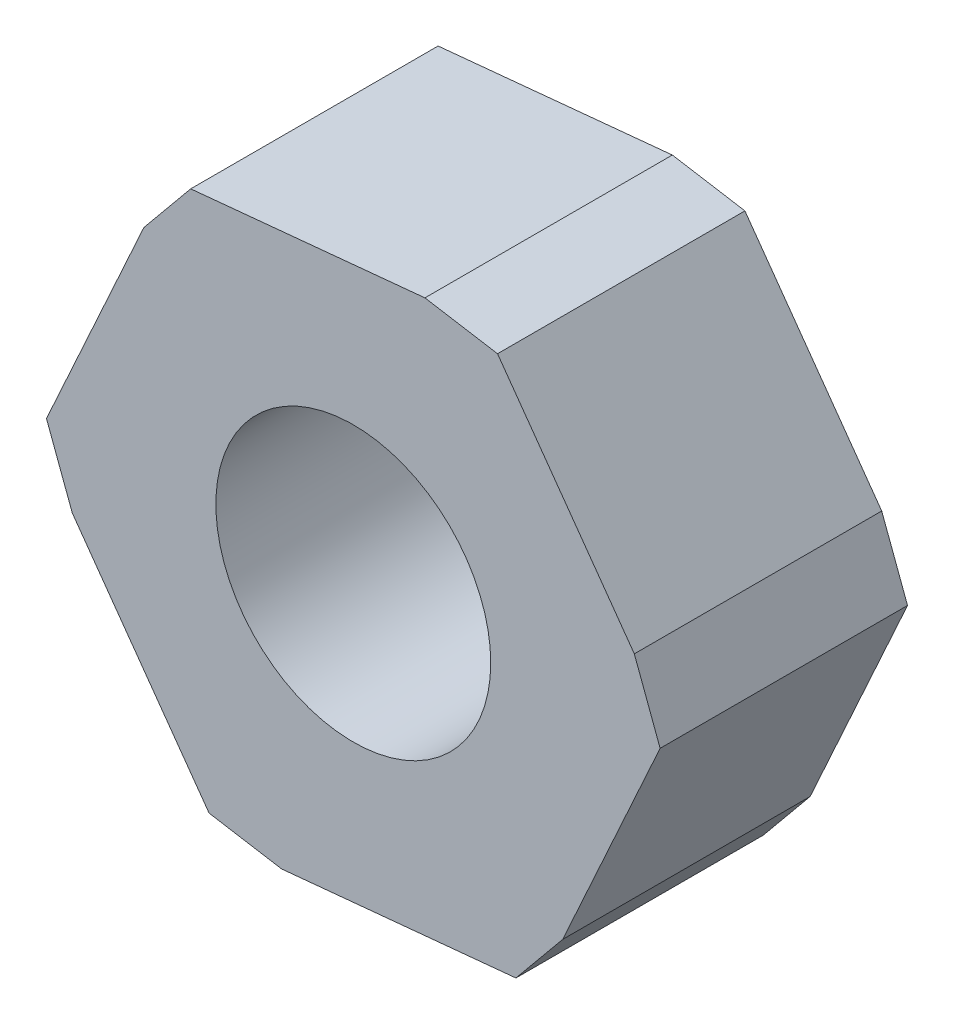
from build123d import *
from OCP.BRepFilletAPI import BRepFilletAPI_MakeChamfer

# Parameters (mm, degrees)
RESSALTO_EXTRUS_O1_DEPTH = 4.5
ESBO_O2_R                = 2.5
CORTE_EXTRUS_O1_DEPTH    = 7.5
CHANFRO1_SIZE            = 0.4
CHANFRO1_SIZE2           = 1.092820323


with BuildPart() as part:
    # Esboço1 → Ressalto-extrusão1 (new body)
    with BuildSketch(Plane.XY):
        Polygon((-5.144411163, -2.872547916), (-2.753633945, 2.382689246), (-6.109414221, 7.080781632), (-11.855971715, 6.523636857), (-14.246748933, 1.268399695), (-10.890968657, -3.429692692), align=None)
    extrude(amount=RESSALTO_EXTRUS_O1_DEPTH)

    # Esboço2 → Corte-extrusão1 (cut)
    with BuildSketch(Plane.XY.offset(4.5)):
        with Locations((-8.500191439, 1.82554447)):
            Circle(ESBO_O2_R)
    extrude(amount=-CORTE_EXTRUS_O1_DEPTH, mode=Mode.SUBTRACT)

    # Chanfro1: one chamfer whose edges measure the first distance from different faces: ONE call of the kernel's chamfer builder (chamfer() names one face for all edges)
    chanfro1_edges_1 = [part.edges().sort_by_distance(p)[0] for p in [
        (-10.890968657, -3.429692692, 2.25),
    ]]
    chanfro1_side_1 = [part.faces().sort_by_distance(p)[0] for p in [
        (-12.568858795, -1.080646498, 2.25),
    ]]
    chanfro1_edges_2 = [part.edges().sort_by_distance(p)[0] for p in [
        (-14.246748933, 1.268399695, 2.25),
    ]]
    chanfro1_side_2 = [part.faces().sort_by_distance(p)[0] for p in [
        (-13.051360324, 3.896018276, 2.25),
    ]]
    chanfro1_edges_3 = [part.edges().sort_by_distance(p)[0] for p in [
        (-11.855971715, 6.523636857, 2.25),
    ]]
    chanfro1_side_3 = [part.faces().sort_by_distance(p)[0] for p in [
        (-8.982692968, 6.802209244, 2.25),
    ]]
    chanfro1_edges_4 = [part.edges().sort_by_distance(p)[0] for p in [
        (-6.109414221, 7.080781632, 2.25),
    ]]
    chanfro1_side_4 = [part.faces().sort_by_distance(p)[0] for p in [
        (-4.431524083, 4.731735439, 2.25),
    ]]
    chanfro1_edges_5 = [part.edges().sort_by_distance(p)[0] for p in [
        (-2.753633945, 2.382689246, 2.25),
    ]]
    chanfro1_side_5 = [part.faces().sort_by_distance(p)[0] for p in [
        (-3.949022554, -0.244929335, 2.25),
    ]]
    chanfro1_edges_6 = [part.edges().sort_by_distance(p)[0] for p in [
        (-5.144411163, -2.872547916, 2.25),
    ]]
    chanfro1_side_6 = [part.faces().sort_by_distance(p)[0] for p in [
        (-8.01768991, -3.151120304, 2.25),
    ]]
    chanfro1 = BRepFilletAPI_MakeChamfer(part.part.solid().wrapped)
    for e in chanfro1_edges_1:
        chanfro1.Add(CHANFRO1_SIZE, CHANFRO1_SIZE2, e.wrapped, chanfro1_side_1[0].wrapped)  # the first distance lies on this face
    for e in chanfro1_edges_2:
        chanfro1.Add(CHANFRO1_SIZE, CHANFRO1_SIZE2, e.wrapped, chanfro1_side_2[0].wrapped)  # the first distance lies on this face
    for e in chanfro1_edges_3:
        chanfro1.Add(CHANFRO1_SIZE, CHANFRO1_SIZE2, e.wrapped, chanfro1_side_3[0].wrapped)  # the first distance lies on this face
    for e in chanfro1_edges_4:
        chanfro1.Add(CHANFRO1_SIZE, CHANFRO1_SIZE2, e.wrapped, chanfro1_side_4[0].wrapped)  # the first distance lies on this face
    for e in chanfro1_edges_5:
        chanfro1.Add(CHANFRO1_SIZE, CHANFRO1_SIZE2, e.wrapped, chanfro1_side_5[0].wrapped)  # the first distance lies on this face
    for e in chanfro1_edges_6:
        chanfro1.Add(CHANFRO1_SIZE, CHANFRO1_SIZE2, e.wrapped, chanfro1_side_6[0].wrapped)  # the first distance lies on this face
    add(Compound.cast(chanfro1.Shape()), mode=Mode.REPLACE)


solid = part.part
